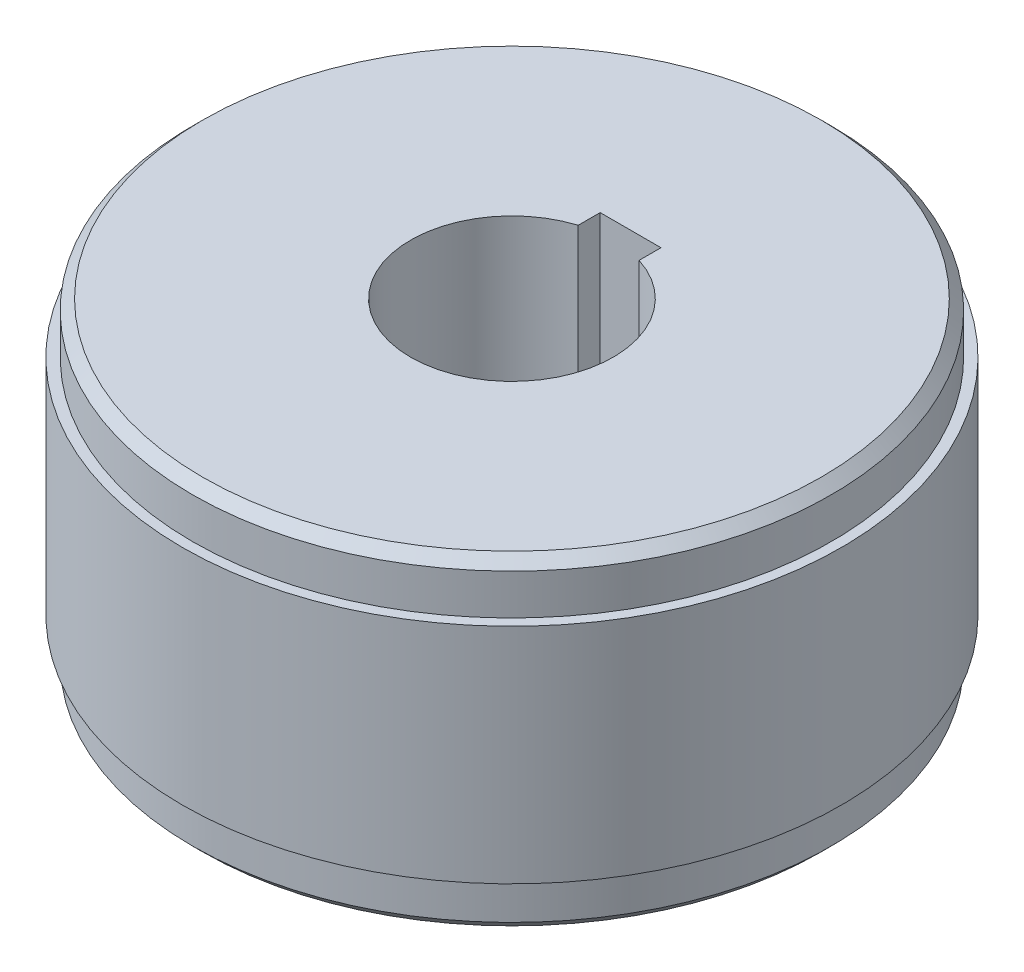
from build123d import *

# Parameters (mm, degrees)
SKETCH_1_R      = 31.5
EXTRUDE_1_DEPTH = 16
SKETCH_2_R      = 32.5
SKETCH_2_R_2    = 31.5
EXTRUDE_2_DEPTH = 11
CHAMFER_1_SIZE  = 1


with BuildPart() as part:
    # 草图1 → 凸台-拉伸1 (new, symmetric)
    with BuildSketch(Plane(origin=(0, 0, 0), x_dir=(1, 0, 0), z_dir=(0, 1, 0))):
        with Locations(Location((0, 0, 0), (0, 0, 270))):
            Circle(SKETCH_1_R)
        with BuildLine():
            Line((-3, 9.539392014), (-3, 11.7))
            Line((-3, 11.7), (3, 11.7))
            Line((3, 11.7), (3, 9.539392014))
            ThreePointArc((3, 9.539392014), (0, -10), (-3, 9.539392014))
        make_face(mode=Mode.SUBTRACT)
    extrude(amount=EXTRUDE_1_DEPTH, both=True)

    # 草图2 → 凸台-拉伸2 (add, symmetric)
    with BuildSketch(Plane(origin=(0, 0, 0), x_dir=(1, 0, 0), z_dir=(0, 1, 0))):
        with Locations(Location((0, 0, 0), (0, 0, 270))):
            Circle(SKETCH_2_R)
        with Locations(Location((0, 0, 0), (0, 0, 270))):
            Circle(SKETCH_2_R_2, mode=Mode.SUBTRACT)
    extrude(amount=EXTRUDE_2_DEPTH, both=True)

    # 倒角1
    chamfer_1_edges = [part.edges().sort_by_distance(p)[0] for p in [
        (0, -16, -31.5),
        (0, 16, -31.5),
    ]]
    chamfer(chamfer_1_edges, length=CHAMFER_1_SIZE)


solid = part.part
